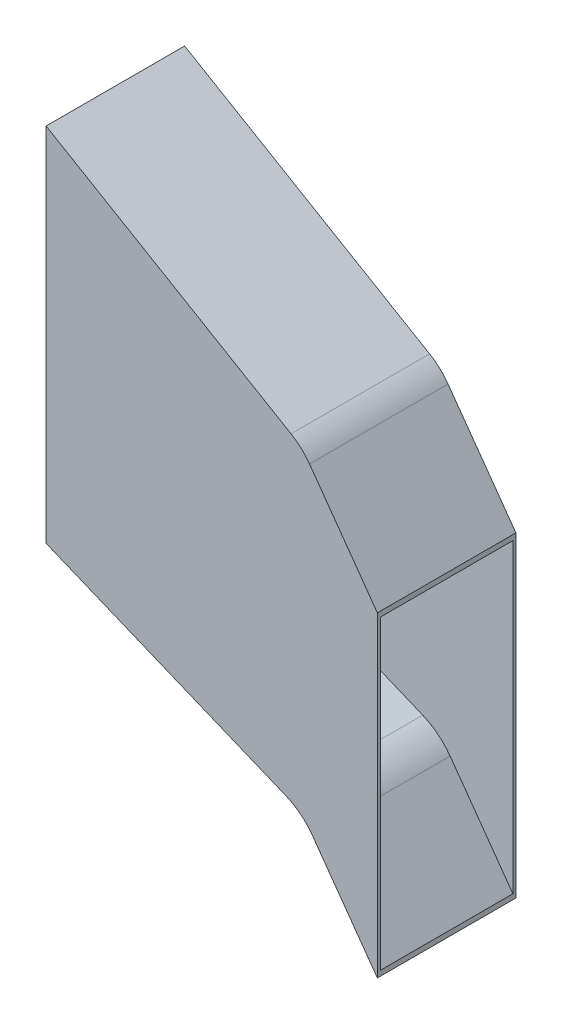
from build123d import *

# Parameters (mm, degrees)
BOSS_EXTRUDE1_DEPTH = 116.84
FILLET1_R           = 50.8
SHELL2_T            = -2.54


with BuildPart() as part:
    # Sketch1 → Boss-Extrude1 (new body)
    with BuildSketch(Plane.XY):
        Polygon((0, 0), (0, 266.7), (-63.5, 355.6), (-279.4, 482.6), (-279.4, 177.8), (-63.5, 88.9), align=None)
    extrude(amount=BOSS_EXTRUDE1_DEPTH)

    # Fillet1
    fillet1_edges = [part.edges().sort_by_distance(p)[0] for p in [
        (-63.5, 88.9, 58.42),
        (-63.5, 355.6, 58.42),
    ]]
    fillet(fillet1_edges, radius=FILLET1_R)

    # Shell2
    shell2_openings = [part.faces().sort_by_distance(p)[0] for p in [
        (-279.4, 330.2, 58.42),
        (0, 133.35, 58.42),
    ]]
    offset(amount=SHELL2_T, openings=shell2_openings, kind=Kind.INTERSECTION)


solid = part.part
